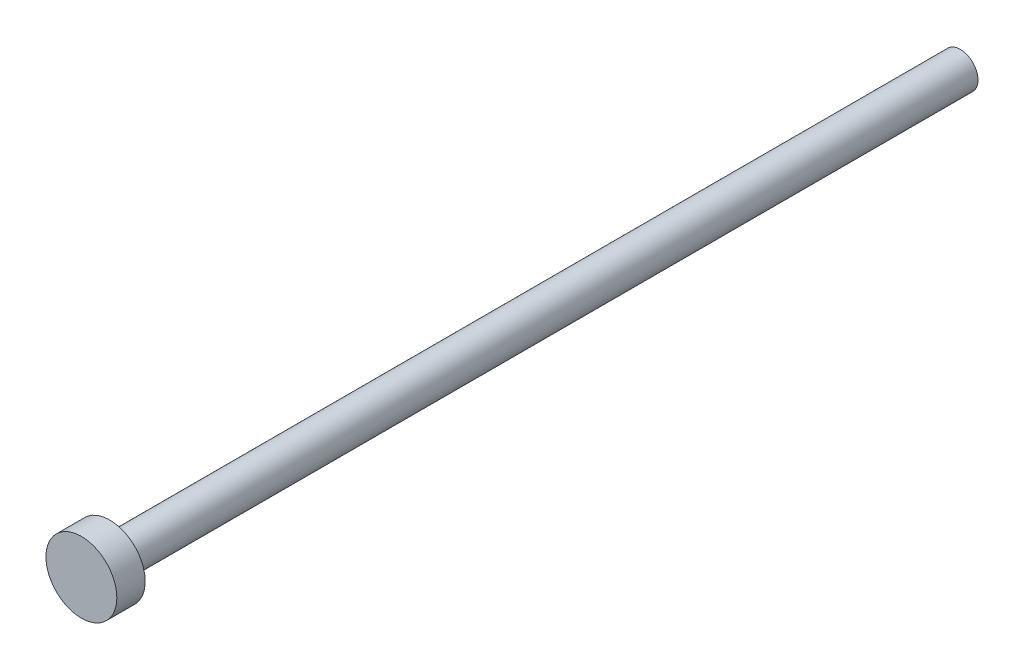
from build123d import *

# Parameters (mm, degrees)
SKETCH1_R           = 1.25
BOSS_EXTRUDE1_DEPTH = 1
SKETCH2_R           = 0.625
BOSS_EXTRUDE2_DEPTH = 30


with BuildPart() as part:
    # Sketch1 → Boss-Extrude1 (new body)
    with BuildSketch(Plane.XY):
        Circle(SKETCH1_R)
    extrude(amount=BOSS_EXTRUDE1_DEPTH)

    # Sketch2 → Boss-Extrude2 (add)
    with BuildSketch(Plane(origin=(0, 0, 0), x_dir=(-1, 0, 0), z_dir=(0, 0, -1))):
        Circle(SKETCH2_R)
    extrude(amount=BOSS_EXTRUDE2_DEPTH)


solid = part.part
